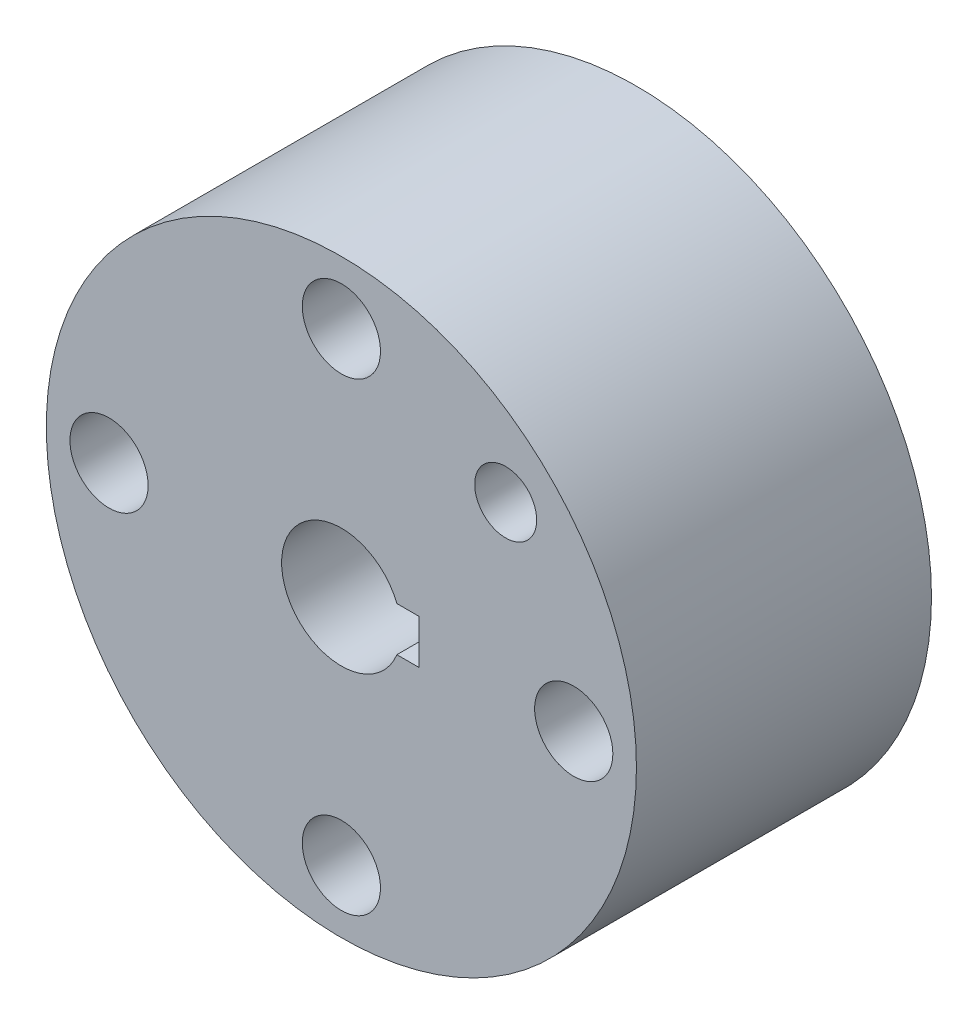
from build123d import *

# Parameters (mm, degrees)
SKETCH1_R                       = 20
SKETCH1_R_2                     = 2.1
SKETCH1_R_3                     = 2.65
SKETCH1_R_4                     = 10
BOSS_EXTRUDE1_DEPTH             = 20
SKIZZE1_R                       = 10
SCHNITT_LINEAR_AUSTRAGEN1_DEPTH = 8


with BuildPart() as part:
    # Sketch1 → Boss-Extrude1 (new body)
    # profile 1 of 2: a face of its own
    with BuildSketch(Plane.XY):
        Circle(SKETCH1_R)
        with Locations((11.136931804, 11.136931804)):
            Circle(SKETCH1_R_2, mode=Mode.SUBTRACT)
        with Locations((-15.75, 0)):
            Circle(SKETCH1_R_3, mode=Mode.SUBTRACT)
        with Locations((0, -15.75)):
            Circle(SKETCH1_R_3, mode=Mode.SUBTRACT)
        with Locations((15.75, 0)):
            Circle(SKETCH1_R_3, mode=Mode.SUBTRACT)
        with Locations((0, 15.75)):
            Circle(SKETCH1_R_3, mode=Mode.SUBTRACT)
        Circle(SKETCH1_R_4, mode=Mode.SUBTRACT)
    # profile 2 of 2: a face of its own
    with BuildSketch(Plane.XY):
        Circle(SKETCH1_R_4)
        with BuildLine():
            Line((5.25, -1.5), (3.761980861, -1.5))
            ThreePointArc((3.761980861, -1.5), (-4.05, 0), (3.761980861, 1.5))
            Line((3.761980861, 1.5), (5.25, 1.5))
            Line((5.25, 1.5), (5.25, -1.5))
        make_face(mode=Mode.SUBTRACT)
    extrude(amount=BOSS_EXTRUDE1_DEPTH)

    # Skizze1 → Schnitt-Linear austragen1 (cut)
    with BuildSketch(Plane(origin=(0, 0, 0), x_dir=(-1, 0, 0), z_dir=(0, 0, -1))):
        Circle(SKIZZE1_R)
    extrude(amount=-SCHNITT_LINEAR_AUSTRAGEN1_DEPTH, mode=Mode.SUBTRACT)


solid = part.part
